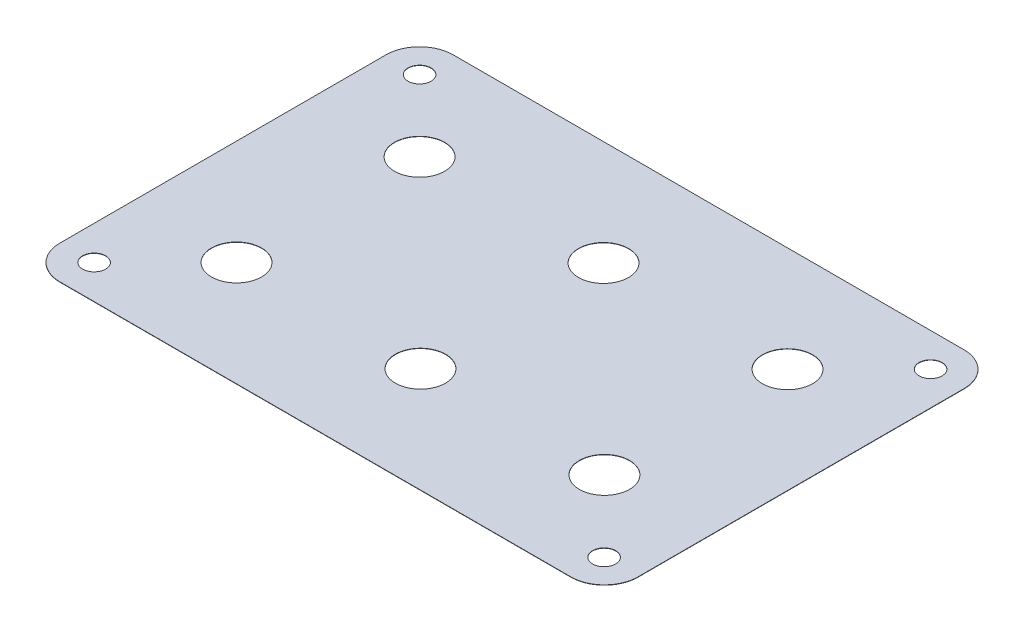
from build123d import *

# Parameters (mm, degrees)
SKETCH1_R           = 266.445848846
SKETCH1_R_2         = 266.44594574
SKETCH1_R_3         = 266.445751953
SKETCH1_R_4         = 122.427943802
SKETCH1_R_5         = 122.428089142
SKETCH1_R_6         = 122.428186035
BOSS_EXTRUDE1_DEPTH = 3.175


with BuildPart() as part:
    # Sketch1 → Boss-Extrude1 (new body)
    with BuildSketch(Plane(origin=(0, 0, 0), x_dir=(1, 0, 0), z_dir=(0, 1, 0))):
        with BuildLine():
            Line((7739.126062012, 9888.219689941), (2313.685906982, 9888.219689941))
            add(Edge.make_bspline(
                [(2313.685906982, 9888.219689941), (2116.581852722, 9888.219689941), (1956.815829468, 10047.985906982), (1956.815829468, 10245.089379883)],
                knots=[1, 1, 1, 1, 2, 2, 2, 2], degree=3))
            Line((1956.815829468, 10245.089379883), (1956.815829468, 13707.364093018))
            add(Edge.make_bspline(
                [(1956.815829468, 13707.364093018), (1956.815829468, 13904.467953491), (2116.581852722, 14064.234170532), (2313.685906982, 14064.234170532)],
                knots=[3, 3, 3, 3, 4, 4, 4, 4], degree=3))
            Line((2313.685906982, 14064.234170532), (7739.126062012, 14064.234170532))
            add(Edge.make_bspline(
                [(7739.126062012, 14064.234170532), (7936.230310059, 14064.234170532), (8095.995751953, 13904.468341064), (8095.995751953, 13707.364093018)],
                knots=[5, 5, 5, 5, 6, 6, 6, 6], degree=3))
            Line((8095.995751953, 13707.364093018), (8095.995751953, 10245.090155029))
            add(Edge.make_bspline(
                [(8095.995751953, 10245.090155029), (8095.995751953, 10047.985906982), (7936.230310059, 9888.219689941), (7739.126062012, 9888.219689941)],
                knots=[7, 7, 7, 7, 8, 8, 8, 8], degree=3))
        make_face()
        with Locations(Location((3072.892085266, 12948.157720947, 0), (0, 0, 270))):
            Circle(SKETCH1_R, mode=Mode.SUBTRACT)
        with Locations(Location((5026.405984497, 12948.157720947, 0), (0, 0, 270))):
            Circle(SKETCH1_R_2, mode=Mode.SUBTRACT)
        with Locations(Location((6980.173937988, 12948.157720947, 0), (0, 0, 270))):
            Circle(SKETCH1_R_3, mode=Mode.SUBTRACT)
        with Locations(Location((3072.892085266, 11004.295751953, 0), (0, 0, 270))):
            Circle(SKETCH1_R, mode=Mode.SUBTRACT)
        with Locations(Location((5026.405984497, 11004.295751953, 0), (0, 0, 270))):
            Circle(SKETCH1_R_2, mode=Mode.SUBTRACT)
        with Locations(Location((6980.173937988, 11004.295751953, 0), (0, 0, 270))):
            Circle(SKETCH1_R_3, mode=Mode.SUBTRACT)
        with Locations(Location((2316.988031006, 13704.315926361, 0), (0, 0, 270))):
            Circle(SKETCH1_R_4, mode=Mode.SUBTRACT)
        with Locations(Location((2316.988031006, 10248.392279053, 0), (0, 0, 270))):
            Circle(SKETCH1_R_5, mode=Mode.SUBTRACT)
        with Locations(Location((7736.078186035, 10244.581658936, 0), (0, 0, 270))):
            Circle(SKETCH1_R_6, mode=Mode.SUBTRACT)
        with Locations(Location((7739.633782959, 13707.871813965, 0), (0, 0, 270))):
            Circle(SKETCH1_R_6, mode=Mode.SUBTRACT)
    extrude(amount=BOSS_EXTRUDE1_DEPTH)


solid = part.part
